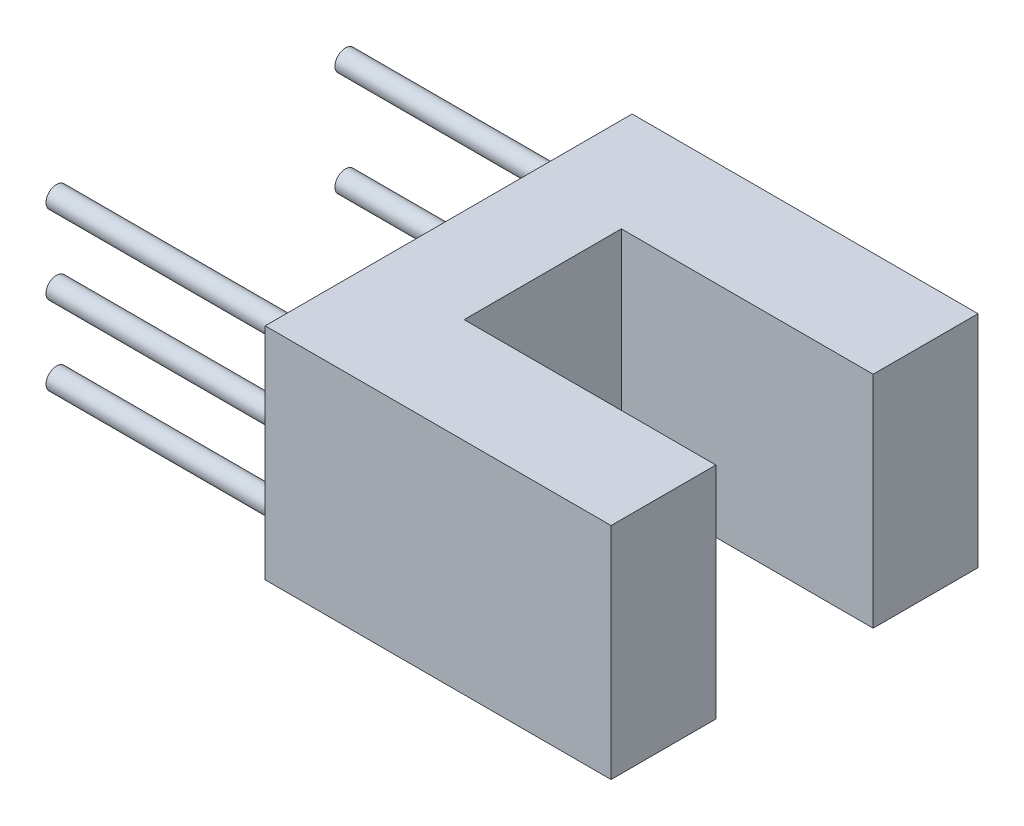
from build123d import *

# Parameters (mm, degrees)
SKETCH1_W           = 8.89
SKETCH1_H           = 5.33
BOSS_EXTRUDE1_DEPTH = 8.38
SKETCH2_W           = 3.81
SKETCH2_H           = 5.33
CUT_EXTRUDE1_DEPTH  = 6.1
SKETCH3_R           = 0.255
BOSS_EXTRUDE2_DEPTH = 6


with BuildPart() as part:
    # Sketch1 → Boss-Extrude1 (new body)
    with BuildSketch(Plane(origin=(0, 0, 0), x_dir=(0, 0, -1), z_dir=(1, 0, 0))):
        with Locations((4.445, 2.665)):
            Rectangle(SKETCH1_W, SKETCH1_H)
    extrude(amount=BOSS_EXTRUDE1_DEPTH)

    # Sketch2 → Cut-Extrude1 (cut)
    with BuildSketch(Plane(origin=(8.38, 0, 0), x_dir=(0, 0, -1), z_dir=(1, 0, 0))):
        with Locations((4.445, 2.665)):
            Rectangle(SKETCH2_W, SKETCH2_H)
    extrude(amount=-CUT_EXTRUDE1_DEPTH, mode=Mode.SUBTRACT)

    # Sketch3 → Boss-Extrude2 (add)
    with BuildSketch(Plane.ZY):
        with Locations((-7.945, 3.935)):
            Circle(SKETCH3_R)
        with Locations((-7.945, 1.395)):
            Circle(SKETCH3_R)
        with Locations((-0.945, 4.57)):
            Circle(SKETCH3_R)
        with Locations((-0.945, 2.665)):
            Circle(SKETCH3_R)
        with Locations((-0.945, 0.76)):
            Circle(SKETCH3_R)
    extrude(amount=BOSS_EXTRUDE2_DEPTH)


solid = part.part
